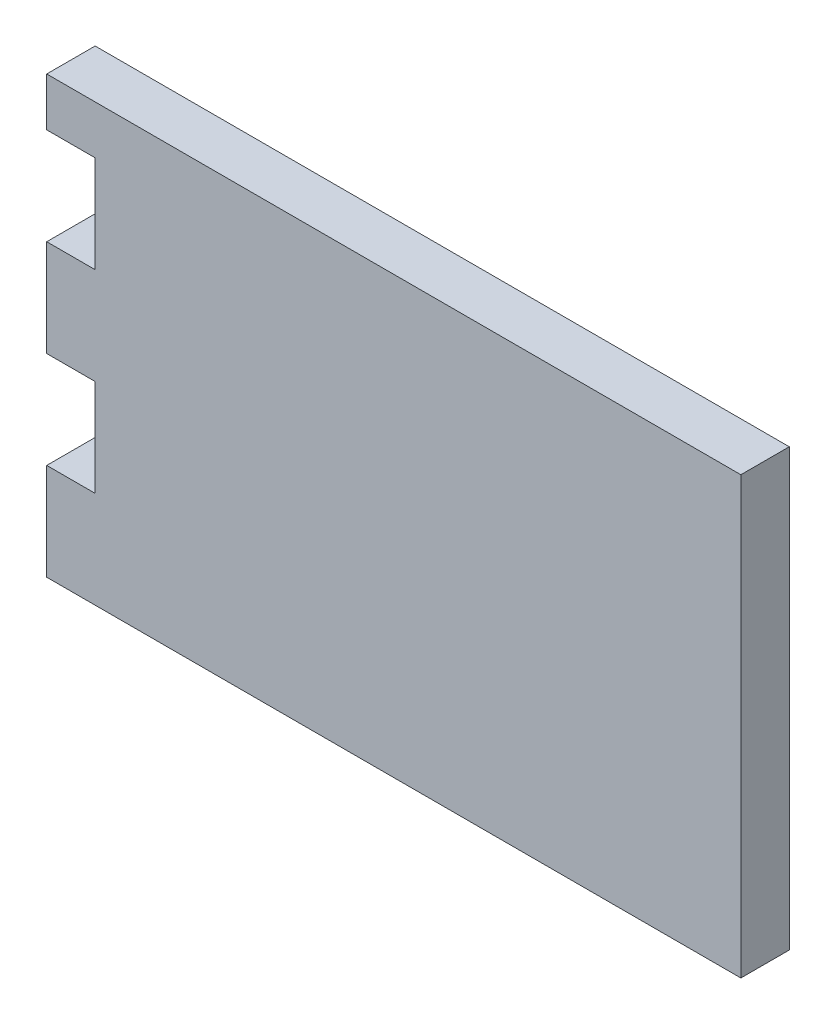
from build123d import *

# Parameters (mm, degrees)
BOSS_EXTRUDE1_DEPTH = 6


with BuildPart() as part:
    # Sketch1 → Boss-Extrude1 (new body)
    with BuildSketch(Plane.XY):
        Polygon((0, -18), (0, -30), (6, -30), (6, -42), (0, -42), (0, -54), (6, -54), (86, -54), (86, 0), (0, 0), (0, -6), (6, -6), (6, -18), align=None)
    extrude(amount=BOSS_EXTRUDE1_DEPTH)


solid = part.part
